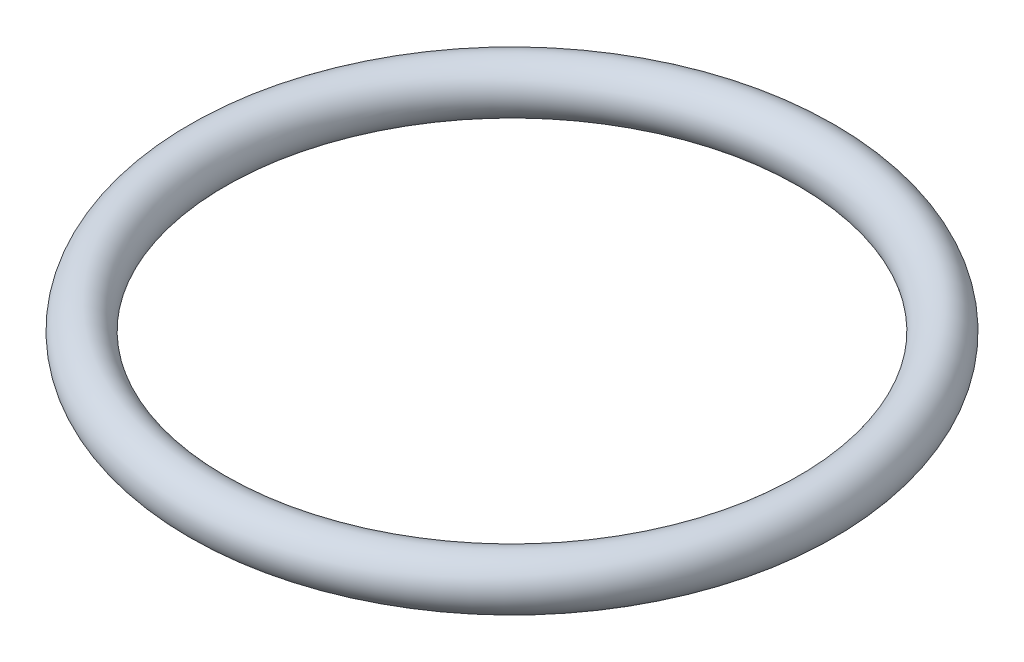
from build123d import *

# Parameters (mm, degrees)
SKETCH1_R = 2.5


with BuildPart() as part:
    # Sketch1 → Revolve1 (revolve)
    with BuildSketch(Plane.XY):
        with Locations((-30.25, 0)):
            Circle(SKETCH1_R)
    revolve(axis=Axis((0, 0, 0), (0, 1, 0)))


solid = part.part
